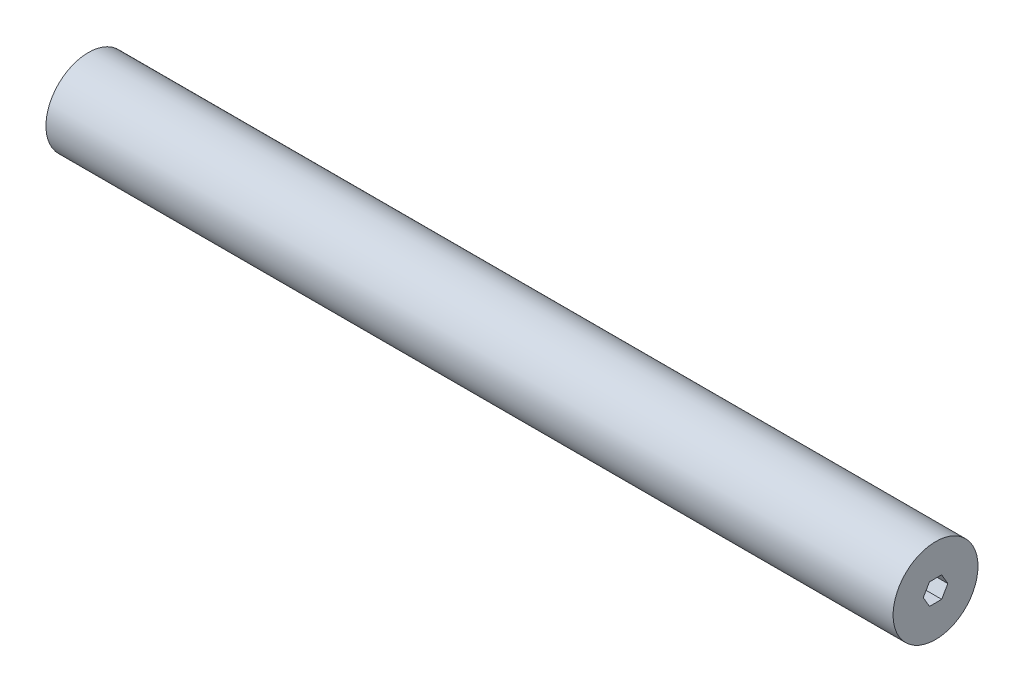
from build123d import *

# Parameters (mm, degrees)
CROQUIS1_R              = 25.4
SALIENTE_EXTRUIR1_DEPTH = 507


with BuildPart() as part:
    # Croquis1 → Saliente-Extruir1 (new body)
    with BuildSketch(Plane(origin=(0, 0, 0), x_dir=(0, 0, -1), z_dir=(1, 0, 0))):
        Circle(CROQUIS1_R)
        Polygon((-7.332348419, 0), (-3.666174209, -6.35), (3.666174209, -6.35), (7.332348419, 0), (3.666174209, 6.35), (-3.666174209, 6.35), align=None, mode=Mode.SUBTRACT)
    extrude(amount=SALIENTE_EXTRUIR1_DEPTH)


solid = part.part
